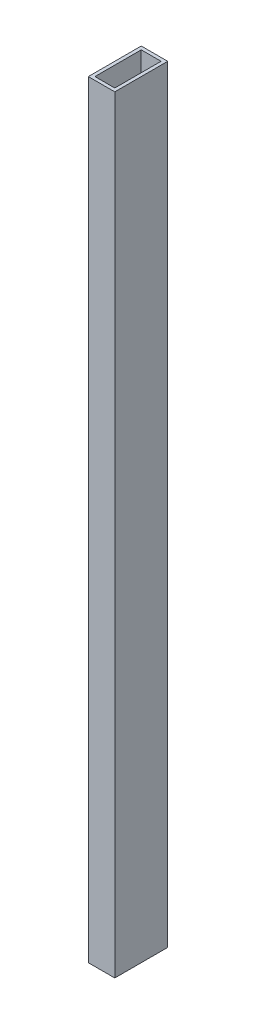
from build123d import *

# Parameters (mm, degrees)
SKETCH1_W           = 25.4
SKETCH1_H           = 50.8
SKETCH1_W_2         = 19.05
SKETCH1_H_2         = 44.45
BOSS_EXTRUDE1_DEPTH = 736.6


with BuildPart() as part:
    # Sketch1 → Boss-Extrude1 (new body)
    with BuildSketch(Plane(origin=(0, 0, 0), x_dir=(1, 0, 0), z_dir=(0, 1, 0))):
        Rectangle(SKETCH1_W, SKETCH1_H)
        Rectangle(SKETCH1_W_2, SKETCH1_H_2, mode=Mode.SUBTRACT)
    extrude(amount=BOSS_EXTRUDE1_DEPTH)


solid = part.part
